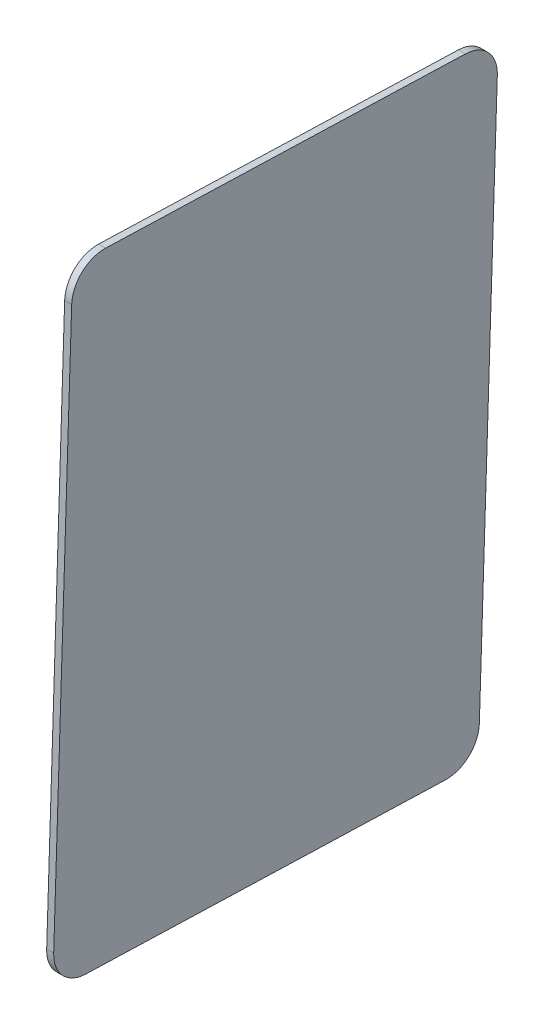
from build123d import *

# Parameters (mm, degrees)
BOSS_EXTRUDE1_DEPTH = 1.5875


with BuildPart() as part:
    # Sketch1 → Boss-Extrude1 (new body)
    with BuildSketch(Plane(origin=(0, 0, 0), x_dir=(0, 0, -1), z_dir=(1, 0, 0))):
        with BuildLine():
            Line((-8.85851075, 93.398229771), (-4.792287106, 218.427125832))
            ThreePointArc((-4.792287106, 218.427125832), (-6.802762766, 223.76536424), (-11.999088317, 226.118447845))
            Line((-11.999088317, 226.118447845), (-93.363070424, 228.764589323))
            ThreePointArc((-93.363070424, 228.764589323), (-98.701308832, 226.754113663), (-101.054392437, 221.557788112))
            Line((-101.054392437, 221.557788112), (-105.120616081, 96.528892051))
            ThreePointArc((-105.120616081, 96.528892051), (-103.11014042, 91.190653643), (-97.91381487, 88.837570038))
            Line((-97.91381487, 88.837570038), (-16.549832763, 86.19142856))
            ThreePointArc((-16.549832763, 86.19142856), (-11.211594355, 88.201904221), (-8.85851075, 93.398229771))
        make_face()
    extrude(amount=-BOSS_EXTRUDE1_DEPTH)


solid = part.part
